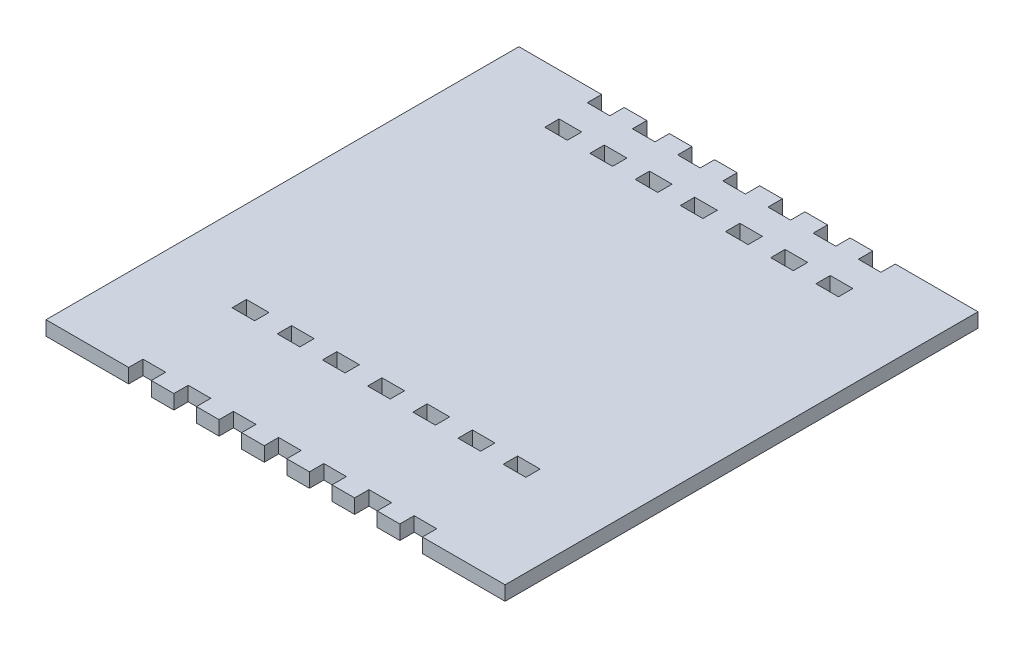
from build123d import *

# Parameters (mm, degrees)
SKETCH1_W           = 5
SKETCH1_H           = 3.175
BOSS_EXTRUDE1_DEPTH = 3.175


with BuildPart() as part:
    # Sketch1 → Boss-Extrude1 (new body)
    with BuildSketch(Plane(origin=(0, 0, 0), x_dir=(1, 0, 0), z_dir=(0, 1, 0))):
        Polygon((-34.46085268, -90.343789474), (-34.46085268, -87.168789474), (-29.46085268, -87.168789474), (-29.46085268, -90.343789474), (-24.46085268, -90.343789474), (-24.46085268, -87.168789474), (-19.46085268, -87.168789474), (-19.46085268, -90.343789474), (-14.46085268, -90.343789474), (-14.46085268, -87.168789474), (-9.46085268, -87.168789474), (-9.46085268, -90.343789474), (-4.46085268, -90.343789474), (-4.46085268, -87.168789474), (0.53914732, -87.168789474), (0.53914732, -90.343789474), (5.53914732, -90.343789474), (5.53914732, -87.168789474), (10.53914732, -87.168789474), (10.53914732, -90.343789474), (15.53914732, -90.343789474), (15.53914732, -87.168789474), (20.53914732, -87.168789474), (20.53914732, -90.343789474), (25.53914732, -90.343789474), (25.53914732, -87.168789474), (30.53914732, -87.168789474), (30.53914732, -90.343789474), (48.83914732, -90.343789474), (48.83914732, 14.304210526), (30.53914732, 14.304210526), (30.53914732, 11.129210526), (25.53914732, 11.129210526), (25.53914732, 14.304210526), (20.53914732, 14.304210526), (20.53914732, 11.129210526), (15.53914732, 11.129210526), (15.53914732, 14.304210526), (10.53914732, 14.304210526), (10.53914732, 11.129210526), (5.53914732, 11.129210526), (5.53914732, 14.304210526), (0.53914732, 14.304210526), (0.53914732, 11.129210526), (-4.46085268, 11.129210526), (-4.46085268, 14.304210526), (-9.46085268, 14.304210526), (-9.46085268, 11.129210526), (-14.46085268, 11.129210526), (-14.46085268, 14.304210526), (-19.46085268, 14.304210526), (-19.46085268, 11.129210526), (-24.46085268, 11.129210526), (-24.46085268, 14.304210526), (-29.46085268, 14.304210526), (-29.46085268, 11.129210526), (-34.46085268, 11.129210526), (-34.46085268, 14.304210526), (-52.76085268, 14.304210526), (-52.76085268, -90.343789474), align=None)
        with Locations((-21.96085268, 3.318710526)):
            Rectangle(SKETCH1_W, SKETCH1_H, mode=Mode.SUBTRACT)
        with Locations((-31.96085268, 3.318710526)):
            Rectangle(SKETCH1_W, SKETCH1_H, mode=Mode.SUBTRACT)
        with Locations((-11.96085268, 3.318710526)):
            Rectangle(SKETCH1_W, SKETCH1_H, mode=Mode.SUBTRACT)
        with Locations((-1.96085268, 3.318710526)):
            Rectangle(SKETCH1_W, SKETCH1_H, mode=Mode.SUBTRACT)
        with Locations((8.03914732, 3.318710526)):
            Rectangle(SKETCH1_W, SKETCH1_H, mode=Mode.SUBTRACT)
        with Locations((18.03914732, 3.318710526)):
            Rectangle(SKETCH1_W, SKETCH1_H, mode=Mode.SUBTRACT)
        with Locations((28.03914732, 3.318710526)):
            Rectangle(SKETCH1_W, SKETCH1_H, mode=Mode.SUBTRACT)
        with Locations((-21.96085268, -65.882289474)):
            Rectangle(SKETCH1_W, SKETCH1_H, mode=Mode.SUBTRACT)
        with Locations((-31.96085268, -65.882289474)):
            Rectangle(SKETCH1_W, SKETCH1_H, mode=Mode.SUBTRACT)
        with Locations((-11.96085268, -65.882289474)):
            Rectangle(SKETCH1_W, SKETCH1_H, mode=Mode.SUBTRACT)
        with Locations((-1.96085268, -65.882289474)):
            Rectangle(SKETCH1_W, SKETCH1_H, mode=Mode.SUBTRACT)
        with Locations((8.03914732, -65.882289474)):
            Rectangle(SKETCH1_W, SKETCH1_H, mode=Mode.SUBTRACT)
        with Locations((18.03914732, -65.882289474)):
            Rectangle(SKETCH1_W, SKETCH1_H, mode=Mode.SUBTRACT)
        with Locations((28.03914732, -65.882289474)):
            Rectangle(SKETCH1_W, SKETCH1_H, mode=Mode.SUBTRACT)
    extrude(amount=BOSS_EXTRUDE1_DEPTH)


solid = part.part
